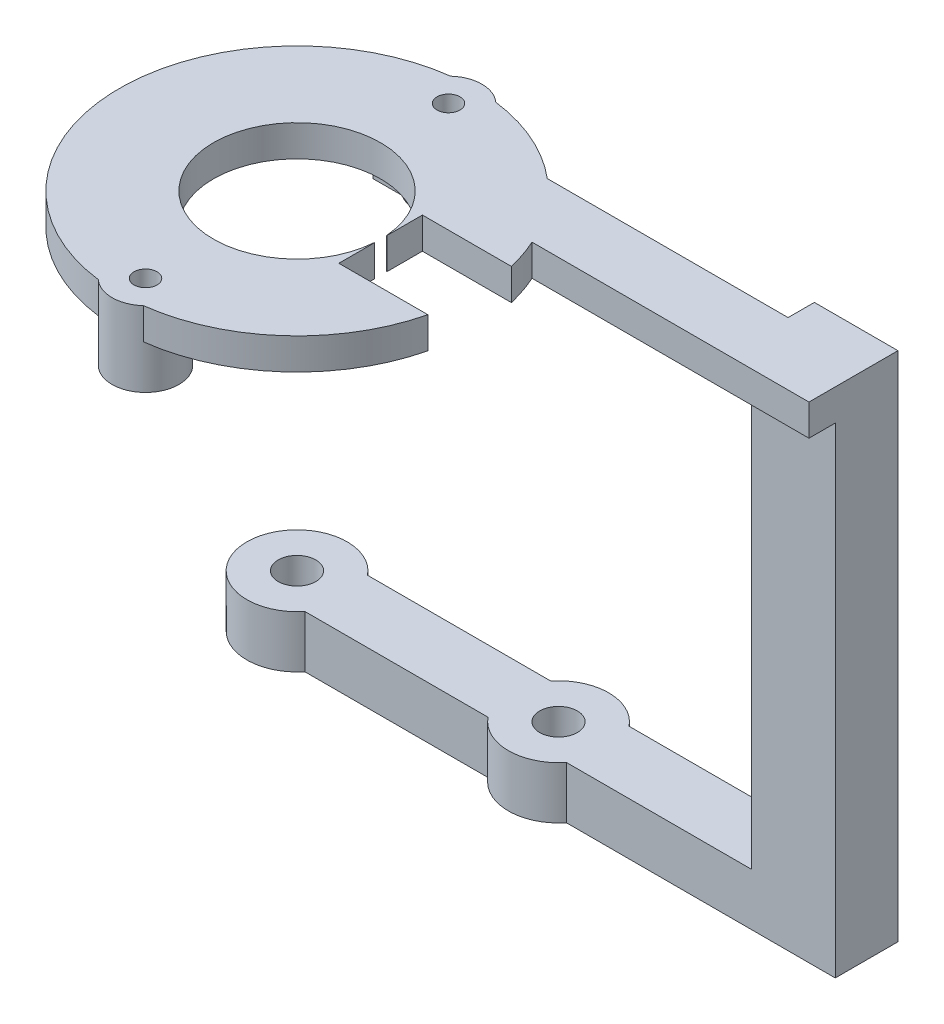
from build123d import *

# Parameters (mm, degrees)
MAIN_PROFILE_SKETCH_R            = 1.1
MAIN_EXTRUSION_DEPTH             = 3
DETAIL_PROFILE_2_SKETCH_R        = 1.1
DETAIL_PROFILE_2_SKETCH_W        = 8
DETAIL_PROFILE_2_SKETCH_H        = 6
DETAIL_EXTRUSION_2_DEPTH         = 0.2
DETAIL_PROFILE_3_SKETCH_R        = 1.6
DETAIL_PROFILE_3_SKETCH_W        = 8
DETAIL_PROFILE_3_SKETCH_H        = 6
DETAIL_EXTRUSION_3_DEPTH         = 2.4
DETAIL_PROFILE_4_SKETCH_R        = 3.2
DETAIL_PROFILE_4_SKETCH_R_2      = 1.6
DETAIL_PROFILE_4_SKETCH_W        = 8
DETAIL_PROFILE_4_SKETCH_H        = 6
DETAIL_EXTRUSION_4_DEPTH         = 1.6
DETAIL_PROFILE_5_SKETCH_W        = 8
DETAIL_PROFILE_5_SKETCH_H        = 6
DETAIL_EXTRUSION_5_DEPTH         = 36.8
DETAIL_PROFILE_6_SKETCH_R        = 1.8
DETAIL_EXTRUSION_6_DEPTH         = 5
CENTRE_BORE_RELIEF_SLOT_SKETCH_W = 9
CENTRE_BORE_RELIEF_SLOT_SKETCH_H = 1.2
CENTRE_BORE_RELIEF_SLOT_DEPTH    = 3.2
ENCODER_CENTRE_OPENING_PROFILE_R = 8
ENCODER_CENTRE_OPENING_DEPTH     = 3.2


with BuildPart() as part:
    # Main Profile Sketch → Main Extrusion (new body)
    with BuildSketch(Plane(origin=(0, -196, 0), x_dir=(-1, 0, 0), z_dir=(0, -1, 0))):
        with BuildLine():
            Line((-14.990817117, 66.244882879), (8.054731733, 66.244882879))
            ThreePointArc((8.054731733, 66.244882879), (12.174217777, 68.810333467), (16.850710954, 70.107296672))
            ThreePointArc((16.850710954, 70.107296672), (19.009182883, 70.944882879), (21.167654813, 70.107296672))
            ThreePointArc((21.167654813, 70.107296672), (36.009182883, 53.244882879), (21.167654813, 36.382469086))
            ThreePointArc((21.167654813, 36.382469086), (20.166826149, 35.761619218), (19.009182883, 35.544882879))
            ThreePointArc((19.009182883, 35.544882879), (17.851539617, 35.761619218), (16.850710954, 36.382469086))
            ThreePointArc((16.850710954, 36.382469086), (7.668676852, 40.580250119), (2.486471241, 49.244882879))
            Line((2.486471241, 49.244882879), (11.009182883, 49.244882879))
            Line((11.009182883, 49.244882879), (11.009182883, 53.244882879))
            Line((11.009182883, 53.244882879), (11.009182883, 57.244882879))
            Line((11.009182883, 57.244882879), (2.486471241, 57.244882879))
            ThreePointArc((2.486471241, 57.244882879), (2.931733644, 58.768977914), (3.517249498, 60.244882879))
            Line((3.517249498, 60.244882879), (-22.990817117, 60.244882879))
            Line((-22.990817117, 60.244882879), (-22.990817117, 68.760672906))
            Line((-22.990817117, 68.760672906), (-14.990817117, 68.760672906))
            Line((-14.990817117, 68.760672906), (-14.990817117, 66.244882879))
        make_face()
        with Locations(Location((19.009182883, 67.744882879, 0), (0, 0, 90))):
            Circle(MAIN_PROFILE_SKETCH_R, mode=Mode.SUBTRACT)
        with Locations(Location((19.009182883, 38.744882879, 0), (0, 0, 90))):
            Circle(MAIN_PROFILE_SKETCH_R, mode=Mode.SUBTRACT)
    extrude(amount=MAIN_EXTRUSION_DEPTH)

    # Detail Profile 2 Sketch → Detail Extrusion 2 (add)
    # profile 1 of 3: a face of its own
    with BuildSketch(Plane(origin=(0, -199, 0), x_dir=(-1, 0, 0), z_dir=(0, -1, 0))):
        with BuildLine():
            Line((16.009182883, 42.994882879), (22.009182883, 42.994882879))
            Line((22.009182883, 42.994882879), (22.009182883, 39.858435751))
            ThreePointArc((22.009182883, 39.858435751), (21.636288628, 36.917777134), (19.009182883, 35.544882879))
            ThreePointArc((19.009182883, 35.544882879), (16.382077138, 36.917777134), (16.009182883, 39.858435751))
            Line((16.009182883, 39.858435751), (16.009182883, 42.994882879))
        make_face()
        with Locations(Location((19.009182883, 38.744882879, 0), (0, 0, 90))):
            Circle(DETAIL_PROFILE_2_SKETCH_R, mode=Mode.SUBTRACT)
    # profile 2 of 3: a face of its own
    with BuildSketch(Plane(origin=(0, -199, 0), x_dir=(-1, 0, 0), z_dir=(0, -1, 0))):
        with Locations((-18.990817117, 65.760672906)):
            Rectangle(DETAIL_PROFILE_2_SKETCH_W, DETAIL_PROFILE_2_SKETCH_H)
    # profile 3 of 3: a face of its own
    with BuildSketch(Plane(origin=(0, -199, 0), x_dir=(-1, 0, 0), z_dir=(0, -1, 0))):
        with BuildLine():
            Line((16.009182883, 66.631330006), (16.009182883, 63.494882879))
            Line((16.009182883, 63.494882879), (22.009182883, 63.494882879))
            Line((22.009182883, 63.494882879), (22.009182883, 66.631330006))
            ThreePointArc((22.009182883, 66.631330006), (19.009182883, 70.944882879), (16.009182883, 66.631330006))
        make_face()
        with Locations(Location((19.009182883, 67.744882879, 0), (0, 0, 90))):
            Circle(DETAIL_PROFILE_2_SKETCH_R, mode=Mode.SUBTRACT)
    extrude(amount=DETAIL_EXTRUSION_2_DEPTH)

    # Detail Profile 3 Sketch → Detail Extrusion 3 (add)
    # profile 1 of 3: a face of its own
    with BuildSketch(Plane(origin=(0, -199.2, 0), x_dir=(-1, 0, 0), z_dir=(0, -1, 0))):
        with BuildLine():
            Line((16.009182883, 42.994882879), (22.009182883, 42.994882879))
            Line((22.009182883, 42.994882879), (22.009182883, 39.858435751))
            ThreePointArc((22.009182883, 39.858435751), (21.636288628, 36.917777134), (19.009182883, 35.544882879))
            ThreePointArc((19.009182883, 35.544882879), (16.382077138, 36.917777134), (16.009182883, 39.858435751))
            Line((16.009182883, 39.858435751), (16.009182883, 42.994882879))
        make_face()
        with Locations(Location((19.009182883, 38.744882879, 0), (0, 0, 90))):
            Circle(DETAIL_PROFILE_3_SKETCH_R, mode=Mode.SUBTRACT)
    # profile 2 of 3: a face of its own
    with BuildSketch(Plane(origin=(0, -199.2, 0), x_dir=(-1, 0, 0), z_dir=(0, -1, 0))):
        with Locations((-18.990817117, 65.760672906)):
            Rectangle(DETAIL_PROFILE_3_SKETCH_W, DETAIL_PROFILE_3_SKETCH_H)
    # profile 3 of 3: a face of its own
    with BuildSketch(Plane(origin=(0, -199.2, 0), x_dir=(-1, 0, 0), z_dir=(0, -1, 0))):
        with BuildLine():
            Line((16.009182883, 66.631330006), (16.009182883, 63.494882879))
            Line((16.009182883, 63.494882879), (22.009182883, 63.494882879))
            Line((22.009182883, 63.494882879), (22.009182883, 66.631330006))
            ThreePointArc((22.009182883, 66.631330006), (19.009182883, 70.944882879), (16.009182883, 66.631330006))
        make_face()
        with Locations(Location((19.009182883, 67.744882879, 0), (0, 0, 90))):
            Circle(DETAIL_PROFILE_3_SKETCH_R, mode=Mode.SUBTRACT)
    extrude(amount=DETAIL_EXTRUSION_3_DEPTH)

    # Detail Profile 4 Sketch → Detail Extrusion 4 (add)
    # profile 1 of 3: a face of its own
    with BuildSketch(Plane(origin=(0, -201.6, 0), x_dir=(-1, 0, 0), z_dir=(0, -1, 0))):
        with Locations(Location((19.009182883, 38.744882879, 0), (0, 0, 227.582921153))):
            Circle(DETAIL_PROFILE_4_SKETCH_R)
        with Locations(Location((19.009182883, 38.744882879, 0), (0, 0, 90))):
            Circle(DETAIL_PROFILE_4_SKETCH_R_2, mode=Mode.SUBTRACT)
    # profile 2 of 3: a face of its own
    with BuildSketch(Plane(origin=(0, -201.6, 0), x_dir=(-1, 0, 0), z_dir=(0, -1, 0))):
        with Locations(Location((19.009182883, 67.744882879, 0), (0, 0, 339.635865194))):
            Circle(DETAIL_PROFILE_4_SKETCH_R)
        with Locations(Location((19.009182883, 67.744882879, 0), (0, 0, 90))):
            Circle(DETAIL_PROFILE_4_SKETCH_R_2, mode=Mode.SUBTRACT)
    # profile 3 of 3: a face of its own
    with BuildSketch(Plane(origin=(0, -201.6, 0), x_dir=(-1, 0, 0), z_dir=(0, -1, 0))):
        with Locations((-18.990817117, 65.760672906)):
            Rectangle(DETAIL_PROFILE_4_SKETCH_W, DETAIL_PROFILE_4_SKETCH_H)
    extrude(amount=DETAIL_EXTRUSION_4_DEPTH)

    # Detail Profile 5 Sketch → Detail Extrusion 5 (add)
    with BuildSketch(Plane(origin=(0, -203.2, 0), x_dir=(-1, 0, 0), z_dir=(0, -1, 0))):
        with Locations((-18.990817117, 65.760672906)):
            Rectangle(DETAIL_PROFILE_5_SKETCH_W, DETAIL_PROFILE_5_SKETCH_H)
    extrude(amount=DETAIL_EXTRUSION_5_DEPTH)

    # Detail Profile 6 Sketch → Detail Extrusion 6 (add)
    with BuildSketch(Plane(origin=(0, -240, 0), x_dir=(-1, 0, 0), z_dir=(0, -1, 0))):
        with BuildLine():
            Line((-22.990817117, 62.760672906), (2.746394057, 62.760672906))
            ThreePointArc((2.746394057, 62.760672906), (6.493392856, 60.960672906), (10.240391655, 62.760672906))
            Line((10.240391655, 62.760672906), (27.777974111, 62.760672906))
            ThreePointArc((27.777974111, 62.760672906), (36.32497291, 65.760672906), (27.777974111, 68.760672906))
            Line((27.777974111, 68.760672906), (10.240391655, 68.760672906))
            ThreePointArc((10.240391655, 68.760672906), (6.493392856, 70.560672906), (2.746394057, 68.760672906))
            Line((2.746394057, 68.760672906), (-22.990817117, 68.760672906))
            Line((-22.990817117, 68.760672906), (-22.990817117, 62.760672906))
        make_face()
        with Locations(Location((31.52497291, 65.760672906, 0), (0, 0, 90))):
            Circle(DETAIL_PROFILE_6_SKETCH_R, mode=Mode.SUBTRACT)
        with Locations(Location((6.493392856, 65.760672906, 0), (0, 0, 90))):
            Circle(DETAIL_PROFILE_6_SKETCH_R, mode=Mode.SUBTRACT)
    extrude(amount=DETAIL_EXTRUSION_6_DEPTH)

    # Centre Bore Relief Slot Sketch → Centre Bore Relief Slot (cut)
    with BuildSketch(Plane(origin=(0, -199.1, 0), x_dir=(1, 0, 0), z_dir=(0, 1, 0))):
        with Locations((-14.509182883, 53.244882879)):
            Rectangle(CENTRE_BORE_RELIEF_SLOT_SKETCH_W, CENTRE_BORE_RELIEF_SLOT_SKETCH_H)
    extrude(amount=CENTRE_BORE_RELIEF_SLOT_DEPTH, mode=Mode.SUBTRACT)

    # Encoder Centre Opening profile → Encoder Centre Opening (cut)
    with BuildSketch(Plane(origin=(0, -199.1, 0), x_dir=(1, 0, 0), z_dir=(0, 1, 0))):
        with Locations((-19.009182883, 53.244882879)):
            Circle(ENCODER_CENTRE_OPENING_PROFILE_R)
    extrude(amount=ENCODER_CENTRE_OPENING_DEPTH, mode=Mode.SUBTRACT)


solid = part.part
